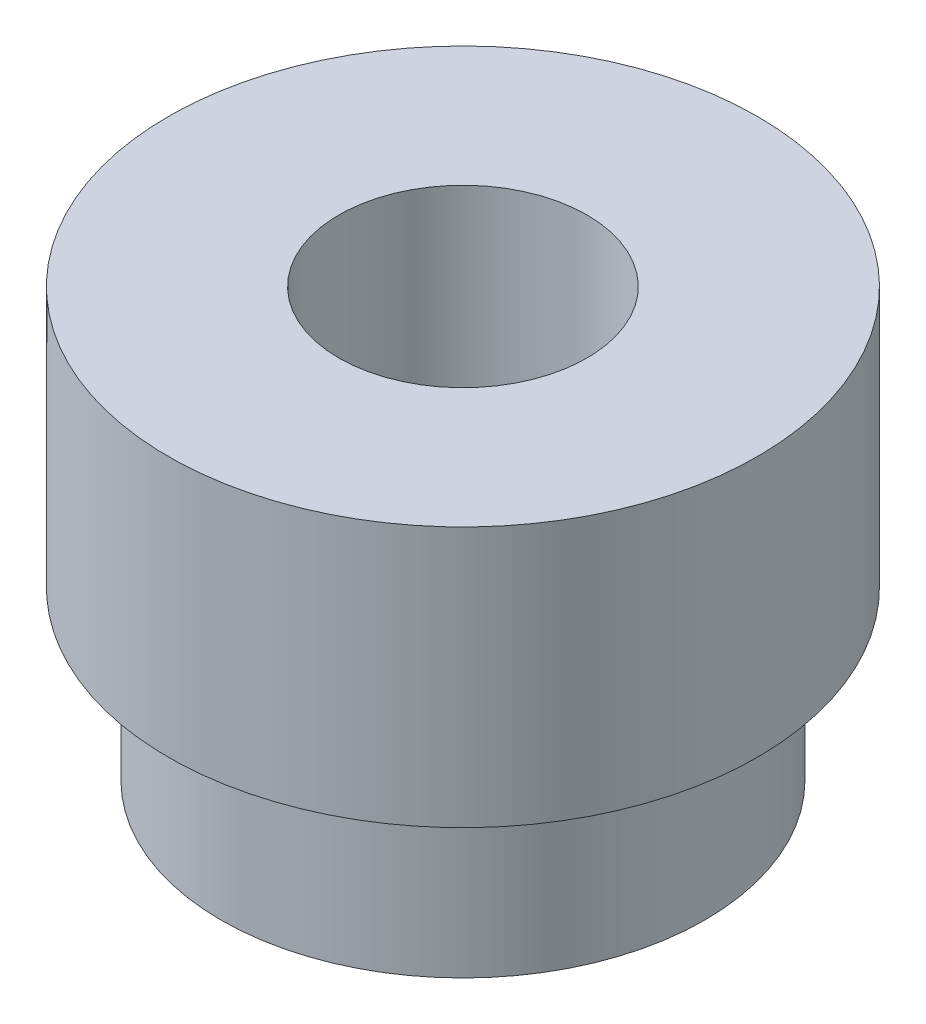
from build123d import *


with BuildPart() as part:
    # Sketch1 → Revolve1 (revolve)
    with BuildSketch(Plane.XY, mode=Mode.PRIVATE) as revolve1_sk:
        Polygon((-1, 0), (-1.95, 0), (-1.95, 1.35), (-2.375, 1.35), (-2.375, 3.45), (-1, 3.45), align=None)
    revolve(revolve1_sk.sketch.rotate(Axis((0, 0, 0), (0, 1, 0)), 270), axis=Axis((0, 0, 0), (0, 1, 0)))


solid = part.part
